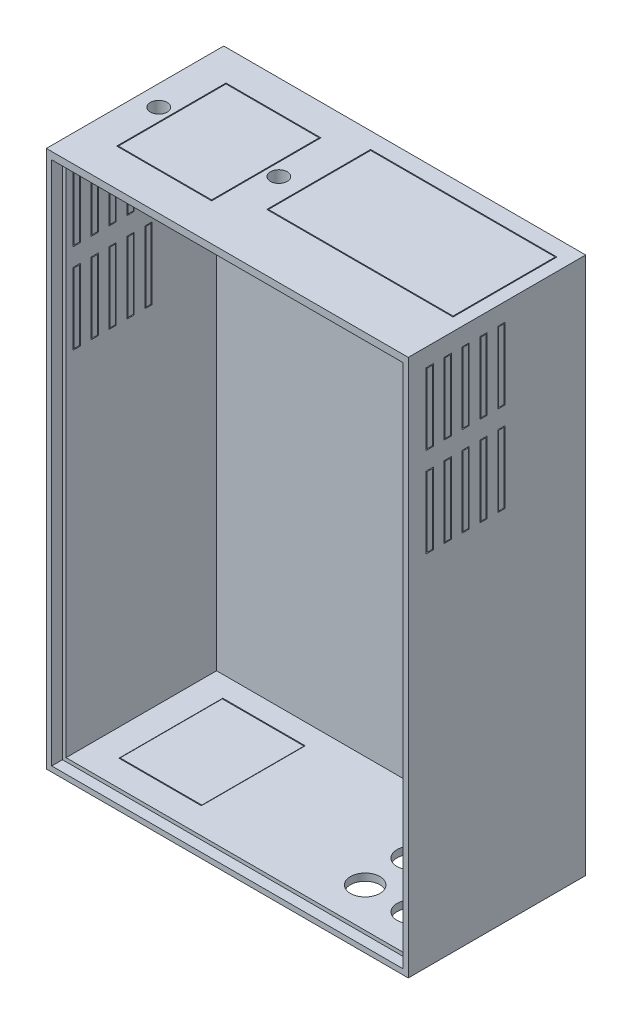
from build123d import *

# Parameters (mm, degrees)
SKETCH1_W             = 101
SKETCH1_H             = 150
BOSS_EXTRUDE1_DEPTH   = 49.5
SKETCH3_W             = 96
SKETCH3_H             = 143.3
CUT_EXTRUDE1_DEPTH    = 45
SKETCH4_R             = 1.7
CUT_EXTRUDE2_DEPTH    = 130.203149324
SKETCH5_R             = 3.2
CUT_EXTRUDE3_DEPTH    = 3
SKETCH6_W             = 26.5
SKETCH6_H             = 30.5
CUT_EXTRUDE4_DEPTH    = 4.2
SKETCH7_R             = 2.35
CUT_EXTRUDE5_DEPTH    = 4.2
SKETCH8_W             = 23
SKETCH8_H             = 29
CUT_EXTRUDE6_DEPTH    = 10
SKETCH9_W             = 28
SKETCH9_H             = 34
CUT_EXTRUDE7_DEPTH    = 1
SKETCH10_W            = 0.949786325
SKETCH10_H            = 5.291666666
CUT_EXTRUDE8_DEPTH    = 0.5
CUT_EXTRUDE9_DEPTH    = 0.5
SKETCH12_W            = 2
SKETCH12_H            = 20
CUT_EXTRUDE10_DEPTH   = 154.28379591
LPATTERN1_COUNT       = 5
LPATTERN1_PITCH       = 5
LPATTERN1_COUNT_DIR2  = 2
LPATTERN1_PITCH_DIR2  = 25
SKETCH13_W            = 52
SKETCH13_H            = 29
CUT_EXTRUDE11_DEPTH   = 10
SKETCH14_R            = 4.1
CUT_EXTRUDE12_DEPTH   = 10
SKETCH15_R            = 5.25
CUT_EXTRUDE13_DEPTH   = 0.5
SKETCH16_W            = 26
SKETCH16_H            = 30
BOSS_EXTRUDE2_DEPTH   = 4.2
SKETCH16_W_2          = 51.5
SKETCH16_H_2          = 28.5
BOSS_EXTRUDE2_2_DEPTH = 4.2
SKETCH17_W            = 22.8
SKETCH17_H            = 28.5
BOSS_EXTRUDE3_DEPTH   = 1.5
SKETCH18_W            = 1.5
SKETCH18_H            = 19.5
BOSS_EXTRUDE4_DEPTH   = 2.5
LPATTERN2_COUNT       = 5
LPATTERN2_PITCH       = 5
LPATTERN2_COUNT_DIR2  = 2
LPATTERN2_PITCH_DIR2  = 25
SKETCH19_W            = 1.5
SKETCH19_H            = 19.5
BOSS_EXTRUDE5_DEPTH   = 2.5
LPATTERN3_COUNT       = 5
LPATTERN3_PITCH       = 5
LPATTERN3_COUNT_DIR2  = 2
LPATTERN3_PITCH_DIR2  = 25
SKETCH21_W            = 98
SKETCH21_H            = 146.5
CUT_EXTRUDE14_DEPTH   = 3
CUT_EXTRUDE15_DEPTH   = 0.5
SKETCH23_W            = 2.289663462
SKETCH23_H            = 1.102430555
CUT_EXTRUDE16_DEPTH   = 0.5
CUT_EXTRUDE17_DEPTH   = 0.5


with BuildPart() as part:
    # Sketch1 → Boss-Extrude1 (new body)
    with BuildSketch(Plane.XY):
        with Locations((11.336734694, -29.137755102)):
            Rectangle(SKETCH1_W, SKETCH1_H)
    extrude(amount=BOSS_EXTRUDE1_DEPTH)

    # Sketch3 → Cut-Extrude1 (cut)
    with BuildSketch(Plane.XY.offset(49.5)):
        with Locations((11.336734694, -29.987755102)):
            Rectangle(SKETCH3_W, SKETCH3_H)
    extrude(amount=-CUT_EXTRUDE1_DEPTH, mode=Mode.SUBTRACT)

    # Sketch4 → Cut-Extrude2 (cut, through all)
    with BuildSketch(Plane.XY.offset(4.5)):
        with Locations((32.936734694, 33.662244898)):
            Circle(SKETCH4_R)
        with Locations((32.936734694, -21.337755102)):
            Circle(SKETCH4_R)
    extrude(amount=-CUT_EXTRUDE2_DEPTH, mode=Mode.SUBTRACT)

    # Sketch5 → Cut-Extrude3 (cut)
    with BuildSketch(Plane(origin=(0, 0, 0), x_dir=(-1, 0, 0), z_dir=(0, 0, -1))):
        with Locations((-32.936734694, 33.662244898)):
            Circle(SKETCH5_R)
        with Locations((-32.936734694, -21.337755102)):
            Circle(SKETCH5_R)
    extrude(amount=-CUT_EXTRUDE3_DEPTH, mode=Mode.SUBTRACT)

    # Sketch6 → Cut-Extrude4 (cut)
    with BuildSketch(Plane(origin=(0, 45.862244898, 0), x_dir=(1, 0, 0), z_dir=(0, 1, 0))):
        with Locations((-16.663265306, -23.872073948)):
            Rectangle(SKETCH6_W, SKETCH6_H)
    extrude(amount=-CUT_EXTRUDE4_DEPTH, mode=Mode.SUBTRACT)

    # Sketch7 → Cut-Extrude5 (cut)
    with BuildSketch(Plane(origin=(0, 45.862244898, 0), x_dir=(1, 0, 0), z_dir=(0, 1, 0))):
        with Locations(Location((0.086734694, -23.872073948, 0), (0, 0, 270))):
            Circle(SKETCH7_R)
        with Locations(Location((-33.413265306, -23.872073948, 0), (0, 0, 270))):
            Circle(SKETCH7_R)
    extrude(amount=-CUT_EXTRUDE5_DEPTH, mode=Mode.SUBTRACT)

    # Sketch8 → Cut-Extrude6 (cut)
    with BuildSketch(Plane.XZ.offset(104.137755102)):
        with Locations((-17.663265306, 24.75)):
            Rectangle(SKETCH8_W, SKETCH8_H)
    extrude(amount=-CUT_EXTRUDE6_DEPTH, mode=Mode.SUBTRACT)

    # Sketch9 → Cut-Extrude7 (cut)
    with BuildSketch(Plane.XZ.offset(104.137755102)):
        with Locations((-17.663265306, 24.75)):
            Rectangle(SKETCH9_W, SKETCH9_H)
    extrude(amount=-CUT_EXTRUDE7_DEPTH, mode=Mode.SUBTRACT)

    # Sketch10 → Cut-Extrude8 (cut)
    with BuildSketch(Plane.XZ.offset(104.137755102)):
        with Locations((-17.372253718, 45.388248418)):
            Rectangle(SKETCH10_W, SKETCH10_H)
    extrude(amount=-CUT_EXTRUDE8_DEPTH, mode=Mode.SUBTRACT)

    # Sketch11 → Cut-Extrude9 (cut)
    with BuildSketch(Plane.XZ.offset(104.137755102)):
        with BuildLine():
            add(Edge.make_bspline(
                [(-17.809030164, 6.672249841), (-17.763056564, 6.67156735), (-17.672660183, 6.67022539), (-17.539523329, 6.655690873), (-17.411275729, 6.633733271), (-17.287415662, 6.603110073), (-17.168834685, 6.562581361), (-17.054669741, 6.514069188), (-16.946279725, 6.455028989), (-16.842282316, 6.388340053), (-16.742717574, 6.312838723), (-16.649978469, 6.226763309), (-16.562371388, 6.132094409), (-16.4817927, 6.0274008), (-16.406457967, 5.91363478), (-16.336614726, 5.79077831), (-16.272797643, 5.65823009), (-16.214291483, 5.515750927), (-16.16197509, 5.361205118), (-16.117909056, 5.192819957), (-16.080115059, 5.01055699), (-16.048214259, 4.813962537), (-16.02410241, 4.602775277), (-16.007850538, 4.377135511), (-15.996697735, 4.137478241), (-15.995787521, 3.973075323), (-15.995319895, 3.888612688)],
                knots=[0, 0, 0, 0, 0.879237366, 1.728815576, 2.559023295, 3.367336655, 4.166867292, 4.954216142, 5.737608147, 6.525189134, 7.316157332, 8.124696809, 8.942788509, 9.781158001, 10.649253743, 11.551476218, 12.482711956, 13.461909668, 14.496590415, 15.601789533, 16.789733467, 18.056700938, 19.410929216, 20.8549011, 22.384193279, 24, 24, 24, 24], degree=3))
            add(Edge.make_bspline(
                [(-15.995319895, 3.888612688), (-15.995825272, 3.803093331), (-15.996807211, 3.636930754), (-16.007386913, 3.395081456), (-16.025605659, 3.167803411), (-16.049087295, 2.95512013), (-16.081250712, 2.75714393), (-16.118918545, 2.573362184), (-16.163680147, 2.403841508), (-16.217719826, 2.24896387), (-16.275871847, 2.106234482), (-16.339863496, 1.9739447), (-16.408579408, 1.851736209), (-16.480443447, 1.73776533), (-16.559395464, 1.635391865), (-16.641592641, 1.54113458), (-16.73061399, 1.458583858), (-16.822711369, 1.383485405), (-16.921258676, 1.31858527), (-17.02523962, 1.261824682), (-17.136508, 1.215785104), (-17.253035583, 1.175742338), (-17.376808605, 1.146995952), (-17.50586033, 1.12418664), (-17.641647725, 1.111580815), (-17.734097253, 1.110016979), (-17.7814694, 1.109215653)],
                knots=[0, 0, 0, 0, 1.643780988, 3.193836972, 4.651895693, 6.025988579, 7.305620092, 8.505800249, 9.631074763, 10.672816429, 11.65661981, 12.592235626, 13.49536222, 14.350718032, 15.179365177, 15.97804903, 16.751647189, 17.51006938, 18.259804725, 19.016521909, 19.783502495, 20.571750527, 21.382245291, 22.22305063, 23.089471752, 24, 24, 24, 24], degree=3))
            add(Edge.make_bspline(
                [(-17.7814694, 1.109215653), (-17.828840269, 1.110032436), (-17.921639103, 1.111632503), (-18.057793681, 1.12409291), (-18.187529315, 1.147088353), (-18.312281581, 1.175963031), (-18.431182222, 1.215696505), (-18.544801363, 1.263113555), (-18.652265372, 1.319519985), (-18.753871799, 1.384571331), (-18.849273731, 1.459167319), (-18.939953714, 1.542510062), (-19.025711158, 1.634388307), (-19.10524148, 1.735831166), (-19.179847156, 1.845484589), (-19.248750167, 1.964600765), (-19.311909105, 2.093006263), (-19.371299592, 2.230880067), (-19.422902408, 2.381190442), (-19.468826518, 2.545279642), (-19.506446341, 2.724515484), (-19.53670272, 2.918840387), (-19.560859395, 3.127842666), (-19.578829185, 3.351623199), (-19.589467653, 3.590286219), (-19.590439294, 3.754331201), (-19.590939553, 3.838791307)],
                knots=[0, 0, 0, 0, 0.917216111, 1.796812873, 2.643793957, 3.46689424, 4.273913431, 5.068098542, 5.848489301, 6.620921603, 7.401012384, 8.190319798, 9.003608147, 9.831726257, 10.68377682, 11.569763213, 12.493818149, 13.453288342, 14.474581811, 15.568529029, 16.750744269, 18.018426408, 19.375425659, 20.823733699, 22.36466933, 24, 24, 24, 24], degree=3))
            add(Edge.make_bspline(
                [(-19.590939553, 3.838791307), (-19.590033381, 3.956141976), (-19.58828491, 4.182571604), (-19.566127008, 4.509696581), (-19.533604828, 4.812066956), (-19.485837448, 5.089176938), (-19.426773744, 5.342052862), (-19.351139596, 5.569028912), (-19.26503562, 5.773245812), (-19.191663971, 5.894225134), (-19.156327507, 5.952489892)],
                knots=[0, 0, 0, 0, 1.288568992, 2.486310467, 3.599230591, 4.627010532, 5.572937695, 6.447898582, 7.252493626, 8, 8, 8, 8], degree=3))
            add(Edge.make_bspline(
                [(-19.156327507, 5.952489892), (-19.11523995, 6.009729172), (-19.03490568, 6.121643244), (-18.894438963, 6.2685655), (-18.743525764, 6.394220609), (-18.579066412, 6.495764881), (-18.403661901, 6.575842703), (-18.215806293, 6.632400766), (-18.016193307, 6.665354129), (-17.87911574, 6.669916946), (-17.809030164, 6.672249841)],
                knots=[0, 0, 0, 0, 1.058512271, 2.069600068, 3.047294572, 4.004278952, 4.967380941, 5.939006123, 6.946246673, 8, 8, 8, 8], degree=3))
        make_face()
        with BuildLine():
            add(Edge.make_bspline(
                [(-17.785709518, 5.722463516), (-17.827270034, 5.72049363), (-17.908750706, 5.716631609), (-18.026983045, 5.683848491), (-18.138468758, 5.6332132), (-18.223272962, 5.572281543), (-18.286748065, 5.513871242), (-18.331098575, 5.46101182), (-18.373867652, 5.402024515), (-18.411643454, 5.334247532), (-18.447313672, 5.26011618), (-18.482174227, 5.179293945), (-18.510750729, 5.089795659), (-18.538826384, 4.99314549), (-18.563423277, 4.886671317), (-18.584030081, 4.76950283), (-18.60244045, 4.640878074), (-18.615281901, 4.500712798), (-18.627253987, 4.349153649), (-18.635836146, 4.185863013), (-18.639424131, 4.010884943), (-18.640564642, 3.890380142), (-18.641153228, 3.828191014)],
                knots=[0, 0, 0, 0, 1.076674018, 2.110852608, 3.161083442, 4.239746716, 4.804137807, 5.395870207, 6.026861976, 6.692161227, 7.405688833, 8.16177676, 8.973626916, 9.841385931, 10.773283133, 11.807421078, 12.927755683, 14.143907515, 15.458935494, 16.872852025, 18.386167141, 20, 20, 20, 20], degree=3))
            add(Edge.make_bspline(
                [(-18.641153228, 3.828191014), (-18.640184487, 3.747621991), (-18.638326855, 3.593124918), (-18.628597447, 3.370952746), (-18.609095656, 3.16875818), (-18.584839365, 2.985170872), (-18.550770414, 2.821381436), (-18.51157188, 2.67584027), (-18.463165177, 2.550402672), (-18.407221903, 2.443254531), (-18.345262208, 2.352103831), (-18.278002233, 2.274625325), (-18.207731939, 2.207532594), (-18.132257962, 2.153033995), (-18.051760361, 2.111268782), (-17.966911143, 2.081227579), (-17.877656386, 2.062838108), (-17.816535649, 2.06028808), (-17.785709518, 2.059001978)],
                knots=[0, 0, 0, 0, 1.771748488, 3.397459088, 4.888034009, 6.237357457, 7.467047327, 8.564189669, 9.548206622, 10.417051504, 11.216568818, 11.965764335, 12.669334354, 13.348544111, 14.005342236, 14.656555988, 15.322436492, 16, 16, 16, 16], degree=3))
            add(Edge.make_bspline(
                [(-17.785709518, 2.059001978), (-17.755941242, 2.059882024), (-17.697658659, 2.061605046), (-17.612669601, 2.079291634), (-17.532297908, 2.108046185), (-17.456786248, 2.148721516), (-17.385864527, 2.200446423), (-17.319879365, 2.263448206), (-17.25932841, 2.338354848), (-17.224051149, 2.393946654), (-17.205873447, 2.422592055)],
                knots=[0, 0, 0, 0, 0.992283464, 1.942767638, 2.88273346, 3.832339453, 4.79467288, 5.803907806, 6.868395428, 8, 8, 8, 8], degree=3))
            add(Edge.make_bspline(
                [(-17.205873447, 2.422592055), (-17.184472264, 2.461735081), (-17.139595719, 2.543814831), (-17.087664504, 2.682321348), (-17.043951701, 2.838533808), (-17.006328731, 3.012938357), (-16.980596914, 3.206222871), (-16.958436705, 3.417161713), (-16.947748286, 3.646817088), (-16.946009756, 3.80592316), (-16.945106219, 3.888612688)],
                knots=[0, 0, 0, 0, 0.710965849, 1.490837728, 2.352621235, 3.297892224, 4.334225155, 5.461620853, 6.680770821, 8, 8, 8, 8], degree=3))
            add(Edge.make_bspline(
                [(-16.945106219, 3.888612688), (-16.945455236, 3.972020001), (-16.946127034, 4.13256484), (-16.958452576, 4.363045842), (-16.975616835, 4.573551986), (-17.00072319, 4.763613296), (-17.03302708, 4.93369116), (-17.072841747, 5.083774457), (-17.119780276, 5.214158975), (-17.175443779, 5.324714701), (-17.237094567, 5.418671902), (-17.30253876, 5.499279893), (-17.372053083, 5.568100962), (-17.445521285, 5.625394095), (-17.524643815, 5.669170345), (-17.607909328, 5.700079999), (-17.695488524, 5.718779303), (-17.755229935, 5.721218869), (-17.785709518, 5.722463516)],
                knots=[0, 0, 0, 0, 1.793836731, 3.452829483, 4.963243077, 6.335886805, 7.574563692, 8.684454726, 9.672768357, 10.54971625, 11.340229787, 12.085688095, 12.778991901, 13.440269426, 14.083255152, 14.715733572, 15.344777694, 16, 16, 16, 16], degree=3))
        make_face(mode=Mode.SUBTRACT)
    extrude(amount=-CUT_EXTRUDE9_DEPTH, mode=Mode.SUBTRACT)

    # Sketch12 → Cut-Extrude10 (cut, through all)
    with BuildSketch(Plane.ZY.offset(39.163265306)):
        with Locations((43.5, 30.862244898)):
            Rectangle(SKETCH12_W, SKETCH12_H)
    cut_extrude10 = extrude(amount=-CUT_EXTRUDE10_DEPTH, mode=Mode.SUBTRACT)

    # LPattern1: Cut-Extrude10 5 × 2
    with Locations(*[(0, -j * LPATTERN1_PITCH_DIR2, -i * LPATTERN1_PITCH) for i in range(LPATTERN1_COUNT) for j in range(LPATTERN1_COUNT_DIR2) if (i, j) != (0, 0)]):
        add(cut_extrude10, mode=Mode.SUBTRACT)

    # Sketch13 → Cut-Extrude11 (cut)
    with BuildSketch(Plane.XZ.offset(-41.662244898)):
        with Locations((32.336734694, 19)):
            Rectangle(SKETCH13_W, SKETCH13_H)
    extrude(amount=-CUT_EXTRUDE11_DEPTH, mode=Mode.SUBTRACT)

    # Sketch14 → Cut-Extrude12 (cut)
    with BuildSketch(Plane.XZ.offset(104.137755102)):
        with Locations(Location((48.836734694, 35.531521306, 0), (0, 0, 270))):
            Circle(SKETCH14_R)
        with Locations(Location((35.836734694, 35.531521306, 0), (0, 0, 270))):
            Circle(SKETCH14_R)
        with Locations(Location((35.836734694, 22.531521306, 0), (0, 0, 270))):
            Circle(SKETCH14_R)
        with Locations(Location((48.836734694, 22.531521306, 0), (0, 0, 270))):
            Circle(SKETCH14_R)
    extrude(amount=-CUT_EXTRUDE12_DEPTH, mode=Mode.SUBTRACT)

    # Sketch15 → Cut-Extrude13 (cut)
    with BuildSketch(Plane.XZ.offset(104.137755102)):
        with Locations(Location((35.836734694, 35.531521306, 0), (0, 0, 270))):
            Circle(SKETCH15_R)
        with Locations(Location((48.836734694, 35.531521306, 0), (0, 0, 270))):
            Circle(SKETCH15_R)
        with Locations(Location((35.836734694, 22.531521306, 0), (0, 0, 270))):
            Circle(SKETCH15_R)
        with Locations(Location((48.836734694, 22.531521306, 0), (0, 0, 270))):
            Circle(SKETCH15_R)
    extrude(amount=-CUT_EXTRUDE13_DEPTH, mode=Mode.SUBTRACT)

    # Sketch21 → Cut-Extrude14 (cut)
    with BuildSketch(Plane.XY.offset(49.5)):
        with Locations((11.336734694, -29.387755102)):
            Rectangle(SKETCH21_W, SKETCH21_H)
    extrude(amount=-CUT_EXTRUDE14_DEPTH, mode=Mode.SUBTRACT)

    # Sketch22 → Cut-Extrude15 (cut)
    with BuildSketch(Plane.XZ.offset(104.137755102)):
        Polygon((35.247651691, 45.598919181), (35.247651691, 46.887914907), (36.129596135, 46.887914907), (36.129596135, 45.598919181), (37.486433742, 45.598919181), (37.486433742, 44.716974736), (36.129596135, 44.716974736), (36.129596135, 43.42797901), (35.247651691, 43.42797901), (35.247651691, 44.716974736), (33.890814084, 44.716974736), (33.890814084, 45.598919181), align=None)
    extrude(amount=-CUT_EXTRUDE15_DEPTH, mode=Mode.SUBTRACT)

    # Sketch23 → Cut-Extrude16 (cut)
    with BuildSketch(Plane.XZ.offset(104.137755102)):
        with Locations((48.73807781, 45.126905085)):
            Rectangle(SKETCH23_W, SKETCH23_H)
    extrude(amount=-CUT_EXTRUDE16_DEPTH, mode=Mode.SUBTRACT)

    # Sketch24 → Cut-Extrude17 (cut)
    with BuildSketch(Plane.XZ.offset(104.137755102)):
        with BuildLine():
            Line((8.762091477, 27.555730475), (11.171538258, 27.555730475))
            Line((11.171538258, 27.555730475), (11.171538258, 26.67378603))
            Line((11.171538258, 26.67378603), (9.514712337, 26.67378603))
            Line((9.514712337, 26.67378603), (9.308006608, 25.673118295))
            add(Edge.make_bspline(
                [(9.308006608, 25.673118295), (9.336173222, 25.680963053), (9.391723573, 25.696434527), (9.475410246, 25.711950458), (9.556514294, 25.722007391), (9.609734276, 25.723348852), (9.635555686, 25.723999705)],
                knots=[0, 0, 0, 0, 1.05461699, 2.079921384, 3.068411212, 4, 4, 4, 4], degree=3))
            add(Edge.make_bspline(
                [(9.635555686, 25.723999705), (9.691823245, 25.722710367), (9.802738997, 25.720168797), (9.964994669, 25.696041005), (10.12036406, 25.658040465), (10.268371722, 25.603843855), (10.408873072, 25.533305567), (10.542038426, 25.447974011), (10.668031221, 25.347699315), (10.784613295, 25.232418699), (10.891733774, 25.105837971), (10.984868922, 24.968927521), (11.06441215, 24.823639557), (11.127678083, 24.669070974), (11.177612951, 24.506192565), (11.213697002, 24.334899954), (11.235035304, 24.154990132), (11.237912643, 24.032250524), (11.239380139, 23.969651081)],
                knots=[0, 0, 0, 0, 1.01440847, 1.999622559, 2.951875003, 3.895578053, 4.836219714, 5.782137149, 6.743708247, 7.735272588, 8.734977101, 9.730283169, 10.717124674, 11.717316708, 12.737475749, 13.78628267, 14.87096371, 16, 16, 16, 16], degree=3))
            add(Edge.make_bspline(
                [(11.239380139, 23.969651081), (11.237586835, 23.906340989), (11.234048124, 23.781411672), (11.210961275, 23.597721385), (11.170212572, 23.421787559), (11.114240151, 23.253139222), (11.04050007, 23.093015901), (10.95181753, 22.939758837), (10.846693148, 22.794505607), (10.726158556, 22.658745235), (10.595121643, 22.534657648), (10.455598262, 22.425497561), (10.308568609, 22.333640231), (10.154029135, 22.25940398), (9.992866481, 22.200669579), (9.825031735, 22.157913738), (9.649709239, 22.13339564), (9.530688045, 22.130070283), (9.470191103, 22.128380047)],
                knots=[0, 0, 0, 0, 1.06808661, 2.107647099, 3.116961351, 4.110378221, 5.100014249, 6.085620622, 7.093190682, 8.119403071, 9.144090782, 10.133780668, 11.103064255, 12.062861538, 13.020824475, 13.992378307, 14.979551724, 16, 16, 16, 16], degree=3))
            add(Edge.make_bspline(
                [(9.470191103, 22.128380047), (9.416090488, 22.129762765), (9.309392755, 22.132489775), (9.152231678, 22.149251413), (9.000710947, 22.178886145), (8.855634973, 22.221775276), (8.715477312, 22.274562005), (8.581858228, 22.340581785), (8.454043461, 22.418577512), (8.332395957, 22.50712576), (8.218892314, 22.606871927), (8.115298216, 22.716061293), (8.02098649, 22.833317579), (7.937975261, 22.960087371), (7.866524743, 23.096183374), (7.803160966, 23.240001665), (7.75129708, 23.393044166), (7.724977652, 23.49914173), (7.711602361, 23.553059534)],
                knots=[0, 0, 0, 0, 1.054957082, 2.080596141, 3.077793124, 4.061112343, 5.027190972, 5.994718051, 6.962465889, 7.943658696, 8.924948258, 9.904494768, 10.875059, 11.855380583, 12.854004648, 13.869083016, 14.917087635, 16, 16, 16, 16], degree=3))
            Line((7.711602361, 23.553059534), (8.797072446, 23.553059534))
            add(Edge.make_bspline(
                [(8.797072446, 23.553059534), (8.816914866, 23.515696692), (8.855476343, 23.443086271), (8.928828799, 23.346685027), (9.010942216, 23.264478188), (9.101075887, 23.195662574), (9.199813822, 23.144107088), (9.303132636, 23.105009792), (9.412330281, 23.082416913), (9.486698698, 23.079592579), (9.524252601, 23.078166372)],
                knots=[0, 0, 0, 0, 1.104910296, 2.147267069, 3.153527244, 4.136738762, 5.099945312, 6.05603338, 7.018353, 8, 8, 8, 8], degree=3))
            add(Edge.make_bspline(
                [(9.524252601, 23.078166372), (9.550427168, 23.07915118), (9.601926068, 23.081088808), (9.677801555, 23.091339341), (9.750228041, 23.11075362), (9.819743999, 23.137637882), (9.886536167, 23.171165594), (9.949647056, 23.213492146), (10.010174682, 23.262211577), (10.067197569, 23.318117288), (10.118843868, 23.380439152), (10.164132023, 23.447408244), (10.204625879, 23.517536496), (10.234620298, 23.593601863), (10.25918319, 23.673333007), (10.277272297, 23.757331365), (10.288082579, 23.845695039), (10.289083322, 23.906018442), (10.289593814, 23.93679017)],
                knots=[0, 0, 0, 0, 0.978869489, 1.925942215, 2.855067702, 3.774946051, 4.70828698, 5.642468714, 6.60995405, 7.609372294, 8.622401667, 9.629904756, 10.629323, 11.642352373, 12.678539694, 13.745912462, 14.850161547, 16, 16, 16, 16], degree=3))
            add(Edge.make_bspline(
                [(10.289593814, 23.93679017), (10.289001329, 23.966847617), (10.287848044, 24.025355166), (10.278307836, 24.111265205), (10.261240588, 24.192778285), (10.237986315, 24.270518734), (10.208218071, 24.344014476), (10.171839286, 24.413702991), (10.128694547, 24.479232031), (10.078552219, 24.539267488), (10.025080957, 24.594333716), (9.967635639, 24.642494201), (9.906733818, 24.682464059), (9.844267942, 24.717358909), (9.777744599, 24.742754619), (9.708659632, 24.760243708), (9.637085692, 24.773076498), (9.58826666, 24.773830472), (9.563473688, 24.774213381)],
                knots=[0, 0, 0, 0, 1.166249705, 2.270133367, 3.348514167, 4.393962215, 5.415026464, 6.420877785, 7.440098956, 8.453121383, 9.451844239, 10.415694839, 11.355045125, 12.27538808, 13.187007209, 14.108269027, 15.039275622, 16, 16, 16, 16], degree=3))
            add(Edge.make_bspline(
                [(9.563473688, 24.774213381), (9.536542758, 24.773191501), (9.482567397, 24.771143436), (9.402373519, 24.754478877), (9.323146556, 24.72750937), (9.244445925, 24.690300661), (9.167052866, 24.6416062), (9.088924939, 24.584493181), (9.012677251, 24.514811801), (8.964196851, 24.46291295), (8.939116383, 24.436064008)],
                knots=[0, 0, 0, 0, 0.88288272, 1.769486374, 2.674910571, 3.623812639, 4.617874466, 5.670434592, 6.794841017, 8, 8, 8, 8], degree=3))
            Line((8.939116383, 24.436064008), (8.13985423, 24.619449091))
            Line((8.13985423, 24.619449091), (8.762091477, 27.555730475))
        make_face()
        Polygon((11.816036121, 27.555730475), (12.830484238, 27.555730475), (14.190501933, 23.796866292), (15.553699717, 27.555730475), (16.564967745, 27.555730475), (14.646314567, 22.264063808), (13.731509212, 22.264063808), align=None)
    extrude(amount=-CUT_EXTRUDE17_DEPTH, mode=Mode.SUBTRACT)


with BuildPart() as body_2:
    # Sketch16 → Boss-Extrude2 (new body)
    with BuildSketch(Plane(origin=(0, 45.862244898, 0), x_dir=(1, 0, 0), z_dir=(0, 1, 0))):
        with Locations((-16.663265306, -23.872073948)):
            Rectangle(SKETCH16_W, SKETCH16_H)
    extrude(amount=-BOSS_EXTRUDE2_DEPTH)


with BuildPart() as body_3:
    # Sketch16 → Boss-Extrude2 2 (new body)
    with BuildSketch(Plane(origin=(0, 45.862244898, 0), x_dir=(1, 0, 0), z_dir=(0, 1, 0))):
        with Locations((32.336734694, -19)):
            Rectangle(SKETCH16_W_2, SKETCH16_H_2)
    extrude(amount=-BOSS_EXTRUDE2_2_DEPTH)


with BuildPart() as body_4:
    # Sketch17 → Boss-Extrude3 (new body)
    with BuildSketch(Plane.XZ.offset(103.137755102)):
        with Locations((-17.663265306, 24.75)):
            Rectangle(SKETCH17_W, SKETCH17_H)
    extrude(amount=-BOSS_EXTRUDE3_DEPTH)


with BuildPart() as body_5:
    # Sketch18 → Boss-Extrude4 (new body)
    with BuildSketch(Plane.ZY.offset(39.163265306)):
        with Locations((43.5, 30.862244898)):
            Rectangle(SKETCH18_W, SKETCH18_H)
    boss_extrude4 = extrude(amount=-BOSS_EXTRUDE4_DEPTH)


with BuildPart() as lpattern2_1:
    # LPattern2: Boss-Extrude4 5 × 2
    with Locations(*[(0, -j * LPATTERN2_PITCH_DIR2, -i * LPATTERN2_PITCH) for i in range(LPATTERN2_COUNT) for j in range(LPATTERN2_COUNT_DIR2) if (i, j) != (0, 0)]):
        add(boss_extrude4)


with BuildPart() as body_15:
    # Sketch19 → Boss-Extrude5 (new body)
    with BuildSketch(Plane(origin=(61.836734694, 0, 0), x_dir=(0, 0, -1), z_dir=(1, 0, 0))):
        with Locations((-43.5, 30.862244898)):
            Rectangle(SKETCH19_W, SKETCH19_H)
    boss_extrude5 = extrude(amount=-BOSS_EXTRUDE5_DEPTH)


with BuildPart() as lpattern3_1:
    # LPattern3: Boss-Extrude5 5 × 2
    with Locations(*[(0, -j * LPATTERN3_PITCH_DIR2, -i * LPATTERN3_PITCH) for i in range(LPATTERN3_COUNT) for j in range(LPATTERN3_COUNT_DIR2) if (i, j) != (0, 0)]):
        add(boss_extrude5)


solid = Compound([part.part, body_2.part, body_3.part, body_4.part, body_5.part, lpattern2_1.part, body_15.part, lpattern3_1.part])
